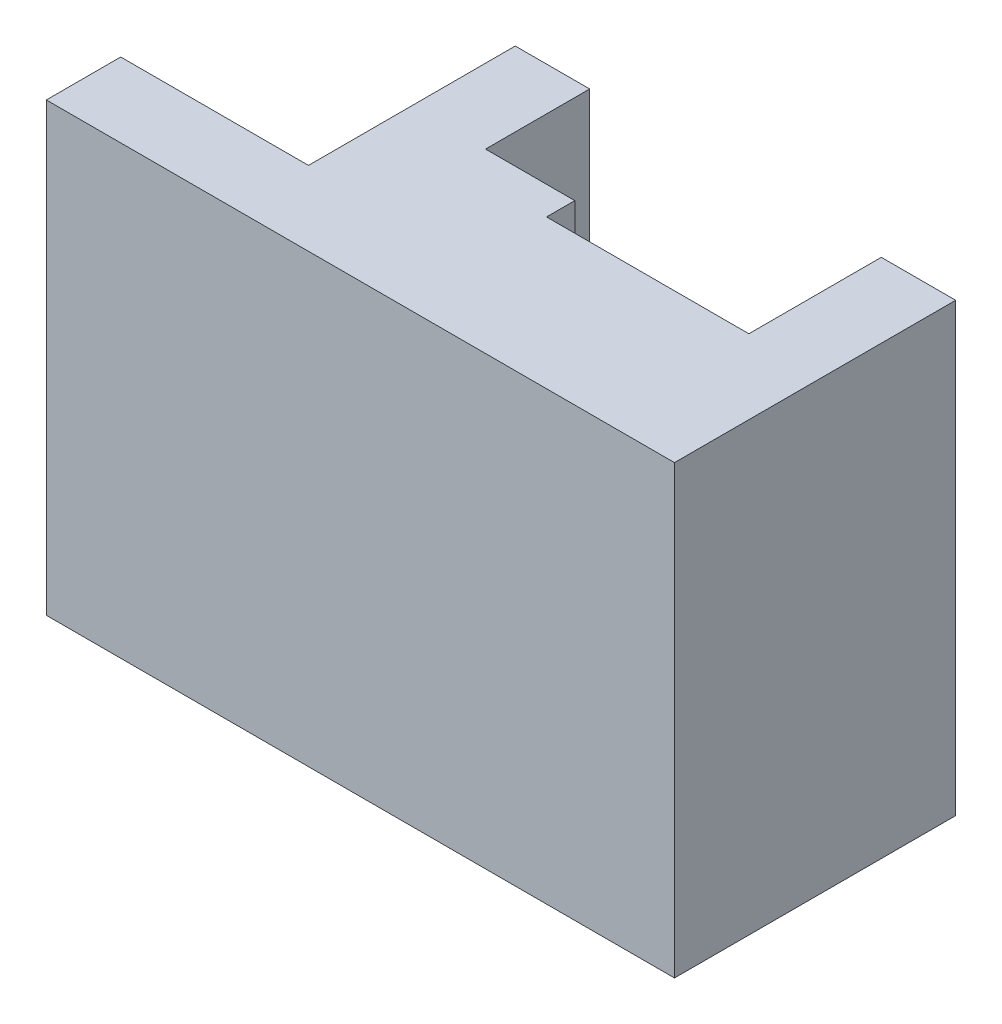
from build123d import *

# Parameters (mm, degrees)
BOSS_EXTRUDE1_DEPTH = 38.1


with BuildPart() as part:
    # Sketch1 → Boss-Extrude1 (new body)
    with BuildSketch(Plane(origin=(0, 0, 0), x_dir=(1, 0, 0), z_dir=(0, 1, 0))):
        Polygon((47.2694, 24.003), (53.6194, 24.003), (53.6194, 0), (0, 0), (0, 6.35), (16.0274, 6.35), (16.0274, 24.003), (22.3774, 24.003), (22.3774, 15.113), (29.9974, 15.113), (29.9974, 12.7), (47.2694, 12.7), align=None)
    extrude(amount=BOSS_EXTRUDE1_DEPTH)


solid = part.part
